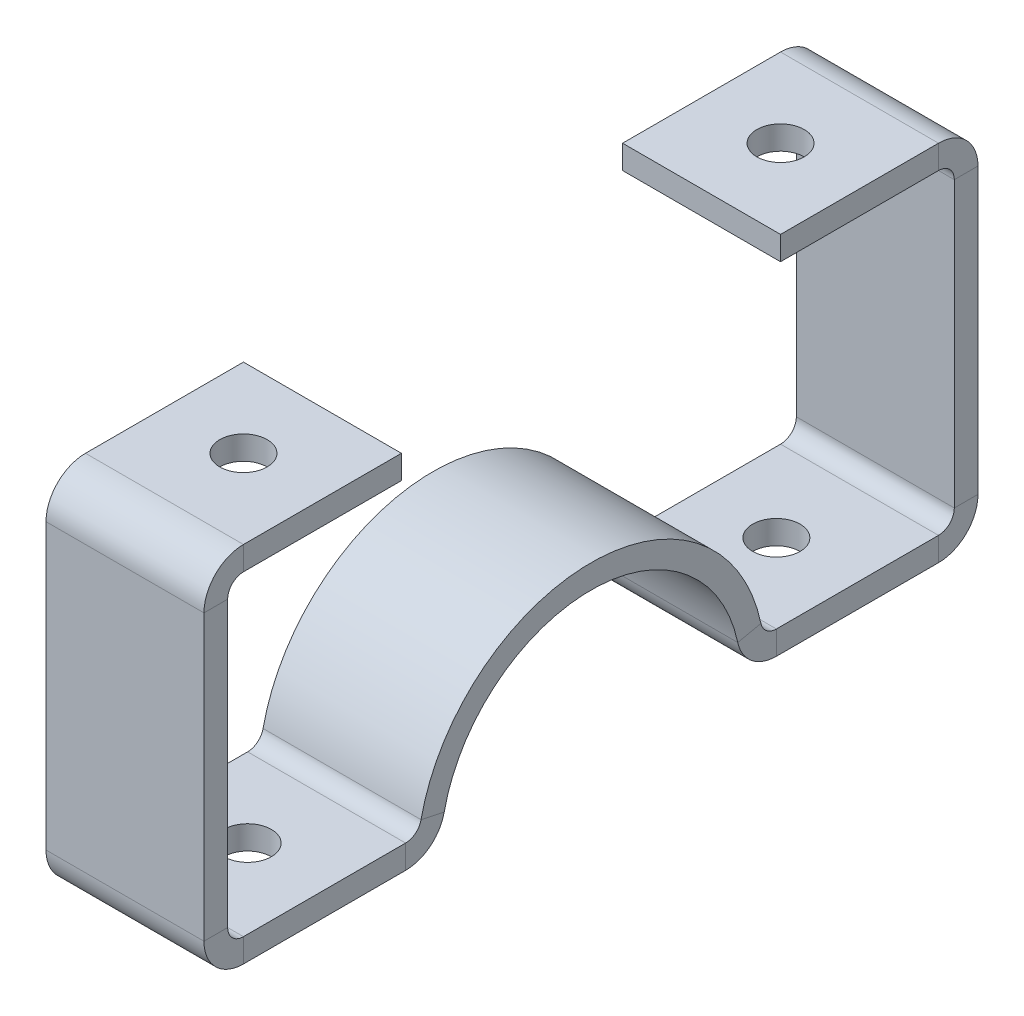
from build123d import *

# Parameters (mm, degrees)
SKETCH8_W          = 20
SKETCH8_H          = 3
SKETCH10_R         = 3
CUT_EXTRUDE1_DEPTH = 66.954529791
SKETCH11_R         = 3
CUT_EXTRUDE2_DEPTH = 66.954529791


with BuildPart() as part:
    # Sweep1: sweep along a path in Sketch7
    with BuildLine(Plane(origin=(0, 0, 0), x_dir=(0, 0, -1), z_dir=(1, 0, 0))) as sweep1_path:
        Line((-24, 46), (-44, 46))
        ThreePointArc((-44, 46), (-47.535533906, 44.535533906), (-49, 41))
        Line((-49, 41), (-49, 5))
        ThreePointArc((-49, 5), (-47.535533906, 1.464466094), (-44, 0))
        Line((-44, 0), (-23.473389189, 0))
        ThreePointArc((-23.473389189, 0), (-20.327624841, 1.113592061), (-18.583099774, 3.958333333))
        ThreePointArc((-18.583099774, 3.958333333), (0, 19), (18.583099774, 3.958333333))
        ThreePointArc((18.583099774, 3.958333333), (20.327624841, 1.113592061), (23.473389189, 0))
        Line((23.473389189, 0), (44, 0))
        ThreePointArc((44, 0), (47.535533906, 1.464466094), (49, 5))
        Line((49, 5), (49, 41))
        ThreePointArc((49, 41), (47.535533906, 44.535533906), (44, 46))
        Line((44, 46), (24, 46))
    # Sketch8 → Sweep1 (sweep)
    with BuildSketch(Plane.XY.offset(24)):
        with Locations((0, 44.5)):
            Rectangle(SKETCH8_W, SKETCH8_H)
    sweep(path=sweep1_path.line)

    # Sketch10 → Cut-Extrude1 (cut, through all)
    with BuildSketch(Plane(origin=(0, 3, 0), x_dir=(1, 0, 0), z_dir=(0, 1, 0))):
        with Locations(Location((0, 33.473389189, 0), (0, 0, 270))):
            Circle(SKETCH10_R)
        with Locations(Location((0, -33.473389189, 0), (0, 0, 270))):
            Circle(SKETCH10_R)
    extrude(amount=-CUT_EXTRUDE1_DEPTH, mode=Mode.SUBTRACT)

    # Sketch11 → Cut-Extrude2 (cut, through all)
    with BuildSketch(Plane.XZ.offset(-43)):
        with Locations(Location((0, 34, 0), (0, 0, 270))):
            Circle(SKETCH11_R)
        with Locations(Location((0, -34, 0), (0, 0, 270))):
            Circle(SKETCH11_R)
    extrude(amount=-CUT_EXTRUDE2_DEPTH, mode=Mode.SUBTRACT)


solid = part.part
